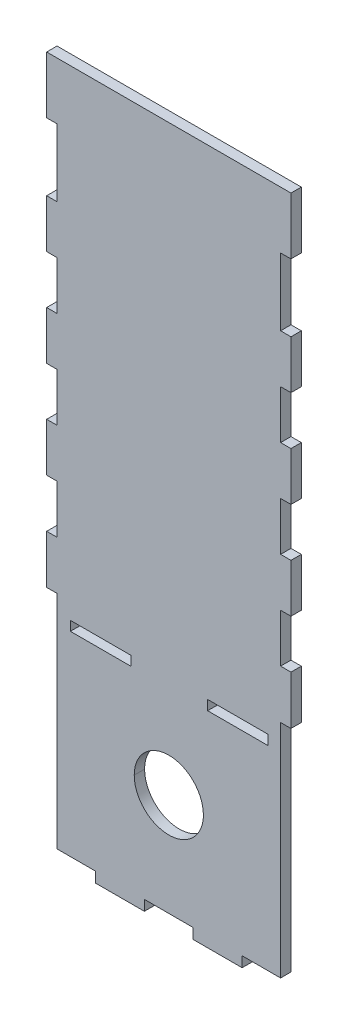
from build123d import *

# Parameters (mm, degrees)
MODEL_W             = 26.170325549
MODEL_H             = 4.242293888
MODEL_W_2           = 26.212023883
MODEL_H_2           = 4.119633054
BOSS_EXTRUDE1_DEPTH = 4.5


with BuildPart() as part:
    # Model → Boss-Extrude1 (new body)
    with BuildSketch(Plane.XY):
        with BuildLine():
            Line((1149.554293324, -552.580562917), (1145.054295269, -552.580562917))
            Line((1145.054295269, -552.580562917), (1145.054295269, -527.830661812))
            Line((1145.054295269, -527.830661812), (1166.254405264, -527.830661812))
            add(Edge.make_bspline(
                [(1198.054358589, -527.830661812), (1180.491599149, -527.830661812), (1166.254405264, -527.830661812)],
                knots=[1, 1, 1, 2, 2, 2], degree=2))
            add(Edge.make_bspline(
                [(1229.854311915, -527.830661812), (1215.617118029, -527.830661812), (1198.054358589, -527.830661812)],
                knots=[0, 0, 0, 1, 1, 1], degree=2))
            Line((1229.854311915, -527.830661812), (1251.054386632, -527.830661812))
            Line((1251.054386632, -527.830661812), (1251.054386632, -552.580562917))
            Line((1251.054386632, -552.580562917), (1246.554388577, -552.580562917))
            Line((1246.554388577, -552.580562917), (1246.554388577, -581.830462077))
            Line((1246.554388577, -581.830462077), (1251.054386632, -581.830462077))
            Line((1251.054386632, -581.830462077), (1251.054386632, -602.83072346))
            Line((1251.054386632, -602.83072346), (1246.554388577, -602.83072346))
            Line((1246.554388577, -602.83072346), (1246.554388577, -623.830667344))
            Line((1246.554388577, -623.830667344), (1251.054386632, -623.830667344))
            Line((1251.054386632, -623.830667344), (1251.054386632, -644.83057595))
            Line((1251.054386632, -644.83057595), (1246.554388577, -644.83057595))
            Line((1246.554388577, -644.83057595), (1246.554388577, -665.830519834))
            Line((1246.554388577, -665.830519834), (1251.054386632, -665.830519834))
            Line((1251.054386632, -665.830519834), (1251.054386632, -686.830428439))
            Line((1251.054386632, -686.830428439), (1246.554388577, -686.830428439))
            Line((1246.554388577, -686.830428439), (1246.554388577, -707.830689823))
            Line((1246.554388577, -707.830689823), (1251.054386632, -707.830689823))
            Line((1251.054386632, -707.830689823), (1251.054386632, -729.002718707))
            Line((1251.054386632, -729.002718707), (1246.554388577, -729.002718707))
            Line((1246.554388577, -729.002718707), (1246.554388577, -825.00268896))
            Line((1246.554388577, -825.00268896), (1229.854311915, -825.00268896))
            Line((1229.854311915, -825.00268896), (1229.854311915, -829.502687015))
            Line((1229.854311915, -829.502687015), (1208.654554698, -829.502687015))
            Line((1208.654554698, -829.502687015), (1208.654554698, -825.00268896))
            Line((1208.654554698, -825.00268896), (1199.604287756, -825.00268896))
            Line((1199.604287756, -825.00268896), (1196.504394145, -825.00268896))
            Line((1196.504394145, -825.00268896), (1187.454127203, -825.00268896))
            Line((1187.454127203, -825.00268896), (1187.454127203, -829.502687015))
            Line((1187.454127203, -829.502687015), (1166.254405264, -829.502687015))
            Line((1166.254405264, -829.502687015), (1166.254405264, -825.00268896))
            Line((1166.254405264, -825.00268896), (1149.554293324, -825.00268896))
            Line((1149.554293324, -825.00268896), (1149.554293324, -729.002718707))
            Line((1149.554293324, -729.002718707), (1145.054295269, -729.002718707))
            Line((1145.054295269, -729.002718707), (1145.054295269, -707.911123156))
            Line((1145.054295269, -707.911123156), (1149.554293324, -707.911123156))
            Line((1149.554293324, -707.911123156), (1149.554293324, -686.830428439))
            Line((1149.554293324, -686.830428439), (1145.054295269, -686.830428439))
            Line((1145.054295269, -686.830428439), (1145.054295269, -665.830519834))
            Line((1145.054295269, -665.830519834), (1149.554293324, -665.830519834))
            Line((1149.554293324, -665.830519834), (1149.554293324, -644.83057595))
            Line((1149.554293324, -644.83057595), (1145.054295269, -644.83057595))
            Line((1145.054295269, -644.83057595), (1145.054295269, -623.830667344))
            Line((1145.054295269, -623.830667344), (1149.554293324, -623.830667344))
            Line((1149.554293324, -623.830667344), (1149.554293324, -602.83072346))
            Line((1149.554293324, -602.83072346), (1145.054295269, -602.83072346))
            Line((1145.054295269, -602.83072346), (1145.054295269, -581.830462077))
            Line((1145.054295269, -581.830462077), (1149.554293324, -581.830462077))
            Line((1149.554293324, -581.830462077), (1149.554293324, -552.580562917))
        make_face()
        with Locations((1227.987059138, -738.28775926)):
            Rectangle(MODEL_W, MODEL_H, mode=Mode.SUBTRACT)
        with Locations((1168.453233875, -738.287741621)):
            Rectangle(MODEL_W_2, MODEL_H_2, mode=Mode.SUBTRACT)
        with BuildLine():
            add(Edge.make_bspline(
                [(1183.054388593, -780.523584805), (1183.054388593, -772.239339529), (1189.770254425, -765.523650086), (1198.054358589, -765.523650086), (1206.338427476, -765.523650086), (1213.054293308, -772.239339529), (1213.054293308, -780.523584805)],
                knots=[2, 2, 2, 2, 3, 3, 3, 4, 4, 4, 4], degree=3))
            add(Edge.make_bspline(
                [(1213.054293308, -780.523584805), (1213.054293308, -788.807830081), (1206.338427476, -795.523519523), (1198.054358589, -795.523519523), (1189.770254425, -795.523519523), (1183.054388593, -788.807830081), (1183.054388593, -780.523584805)],
                knots=[0, 0, 0, 0, 1, 1, 1, 2, 2, 2, 2], degree=3))
        make_face(mode=Mode.SUBTRACT)
    extrude(amount=BOSS_EXTRUDE1_DEPTH)


solid = part.part
